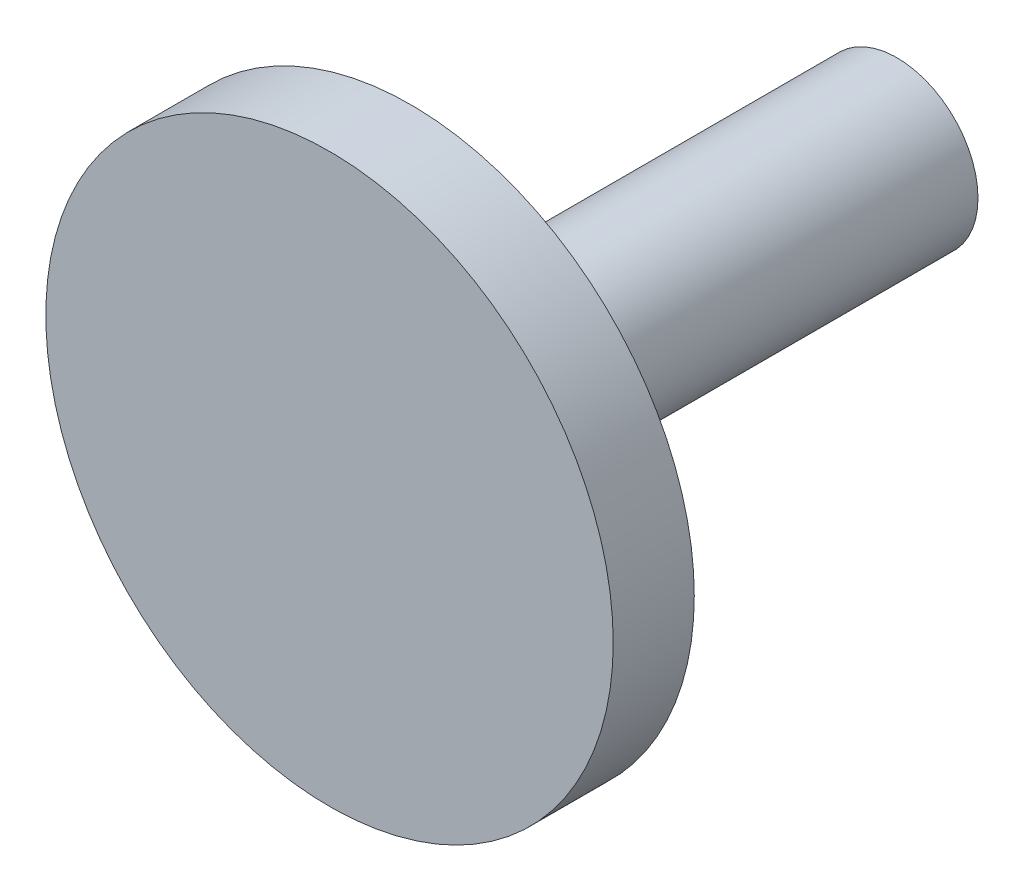
from build123d import *

# Parameters (mm, degrees)
SKETCH1_R           = 17.5
BOSS_EXTRUDE1_DEPTH = 5
SKETCH1_3_R         = 5
BOSS_EXTRUDE2_DEPTH = 30


with BuildPart() as part:
    # Sketch1 → Boss-Extrude1 (new body)
    with BuildSketch(Plane.XY):
        Circle(SKETCH1_R)
    extrude(amount=BOSS_EXTRUDE1_DEPTH)

    # Sketch1<3> → Boss-Extrude2 (add)
    with BuildSketch(Plane.XY):
        Circle(SKETCH1_3_R)
    extrude(amount=-BOSS_EXTRUDE2_DEPTH)


solid = part.part
